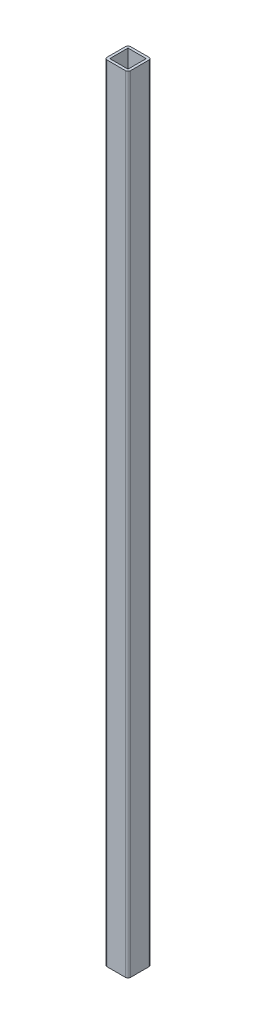
from build123d import *

# Parameters (mm, degrees)
BOSS_EXTRUDE1_DEPTH = 861
SKETCH3_W           = 20
SKETCH3_H           = 20
CUT_EXTRUDE1_DEPTH  = 861


with BuildPart() as part:
    # Sketch1 → Boss-Extrude1 (new body)
    with BuildSketch(Plane(origin=(0, 0, 0), x_dir=(1, 0, 0), z_dir=(0, 1, 0))):
        with BuildLine():
            Line((2.8, 0), (22.8, 0))
            ThreePointArc((22.8, 0), (24.779898987, -0.820101013), (25.6, -2.8))
            Line((25.6, -2.8), (25.6, -22.8))
            ThreePointArc((25.6, -22.8), (24.779898987, -24.779898987), (22.8, -25.6))
            Line((22.8, -25.6), (2.8, -25.6))
            ThreePointArc((2.8, -25.6), (0.820101013, -24.779898987), (0, -22.8))
            Line((0, -22.8), (0, -2.8))
            ThreePointArc((0, -2.8), (0.820101013, -0.820101013), (2.8, 0))
        make_face()
    extrude(amount=BOSS_EXTRUDE1_DEPTH)

    # Sketch3 → Cut-Extrude1 (cut)
    with BuildSketch(Plane(origin=(0, 0, 0), x_dir=(-1, 0, 0), z_dir=(0, -1, 0))):
        with Locations((-12.8, -12.8)):
            Rectangle(SKETCH3_W, SKETCH3_H)
    extrude(amount=-CUT_EXTRUDE1_DEPTH, mode=Mode.SUBTRACT)


solid = part.part
